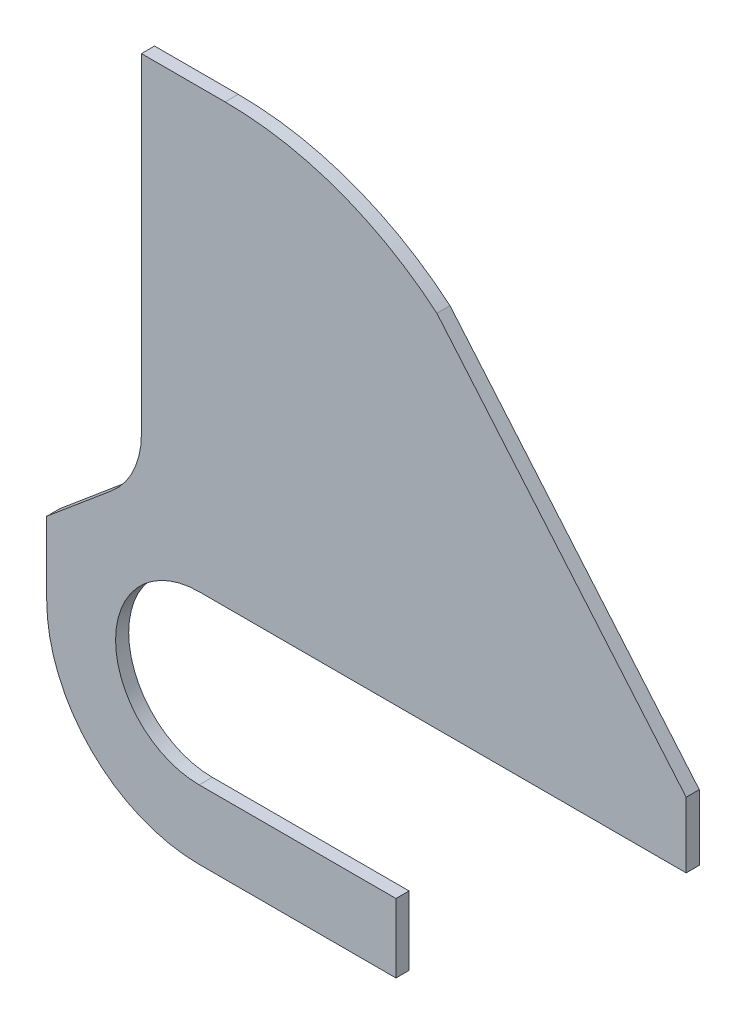
from build123d import *

# Parameters (mm, degrees)
EXTRUDE_1_DEPTH = 4


with BuildPart() as part:
    # 草图1 → 凸台-拉伸1 (new, symmetric)
    with BuildSketch(Plane.XY):
        with BuildLine():
            Line((-692.368123223, 756.238006891), (-692.368123223, 714.238006891))
            Line((-692.368123223, 714.238006891), (-812.368123223, 714.238006891))
            ThreePointArc((-812.368123223, 714.238006891), (-878.129053873, 741.477076241), (-905.368123223, 807.238006891))
            Line((-905.368123223, 807.238006891), (-905.368123223, 851.650469452))
            Line((-905.368123223, 851.650469452), (-865.837171529, 884.820876438))
            ThreePointArc((-865.837171529, 884.820876438), (-852.397642484, 902.335611688), (-847.619339623, 923.889143037))
            Line((-847.619339623, 923.889143037), (-847.619339623, 1124.889143037))
            Line((-847.619339623, 1124.889143037), (-796.619339623, 1124.889143037))
            ThreePointArc((-796.619339623, 1124.889143037), (-727.873290815, 1112.767359815), (-667.419030076, 1077.864076104))
            Line((-667.419030076, 1077.864076104), (-515.368123223, 898.238006891))
            Line((-515.368123223, 898.238006891), (-515.368123223, 858.238006891))
            Line((-515.368123223, 858.238006891), (-812.368123223, 858.238006891))
            ThreePointArc((-812.368123223, 858.238006891), (-863.368123223, 807.238006891), (-812.368123223, 756.238006891))
            Line((-812.368123223, 756.238006891), (-692.368123223, 756.238006891))
        make_face()
    extrude(amount=EXTRUDE_1_DEPTH, both=True)


solid = part.part
